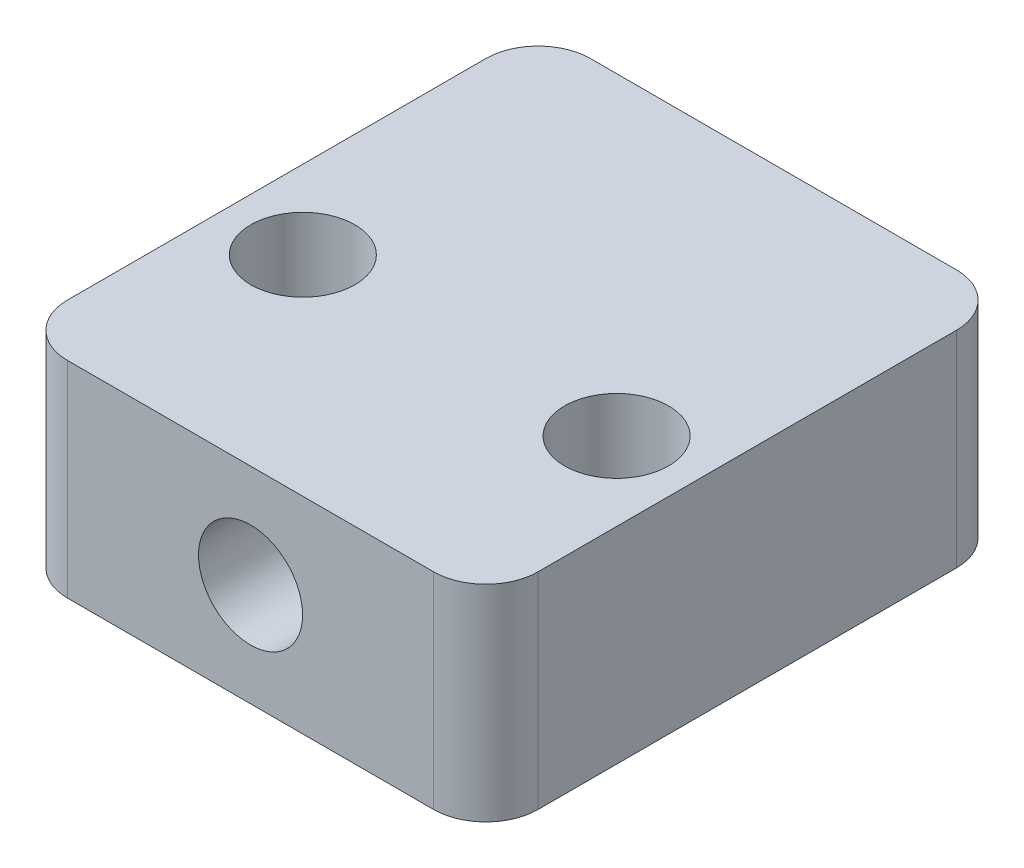
from build123d import *

# Parameters (mm, degrees)
SKETCH1_W           = 22.86
SKETCH1_H           = 25.4
SKETCH1_R           = 2.5273
BOSS_EXTRUDE1_DEPTH = 10
FILLET1_R           = 2.54
CUT_EXTRUDE1_DEPTH  = 30.594001081


with BuildPart() as part:
    # Sketch1 → Boss-Extrude1 (new body)
    with BuildSketch(Plane(origin=(0, 0, 0), x_dir=(1, 0, 0), z_dir=(0, 1, 0))):
        Rectangle(SKETCH1_W, SKETCH1_H)
        with Locations(Location((-7.62, -2.54, 0), (0, 0, 270))):
            Circle(SKETCH1_R, mode=Mode.SUBTRACT)
        with Locations(Location((7.62, -2.54, 0), (0, 0, 270))):
            Circle(SKETCH1_R, mode=Mode.SUBTRACT)
    extrude(amount=BOSS_EXTRUDE1_DEPTH)

    # Fillet1
    fillet1_edges = [part.edges().sort_by_distance(p)[0] for p in [
        (11.43, 5, 12.7),
        (-11.43, 5, 12.7),
        (-11.43, 5, -12.7),
        (11.43, 5, -12.7),
    ]]
    fillet(fillet1_edges, radius=FILLET1_R)

    # Sketch4 → Cut-Extrude1 (cut, through all)
    with BuildSketch(Plane(origin=(0, 0, 12.7), x_dir=(-1, 0, 0), z_dir=(0, 0, -1))):
        with BuildLine():
            ThreePointArc((0, 7.5273), (-2.5273, 5), (0, 2.4727))
            Line((0, 2.4727), (0, 7.5273))
        make_face()
        with BuildLine():
            Line((0, 7.5273), (0, 2.4727))
            ThreePointArc((0, 2.4727), (1.787070968, 3.212929032), (2.5273, 5))
            ThreePointArc((2.5273, 5), (1.787070968, 6.787070968), (0, 7.5273))
        make_face()
    extrude(amount=CUT_EXTRUDE1_DEPTH, mode=Mode.SUBTRACT)


solid = part.part
